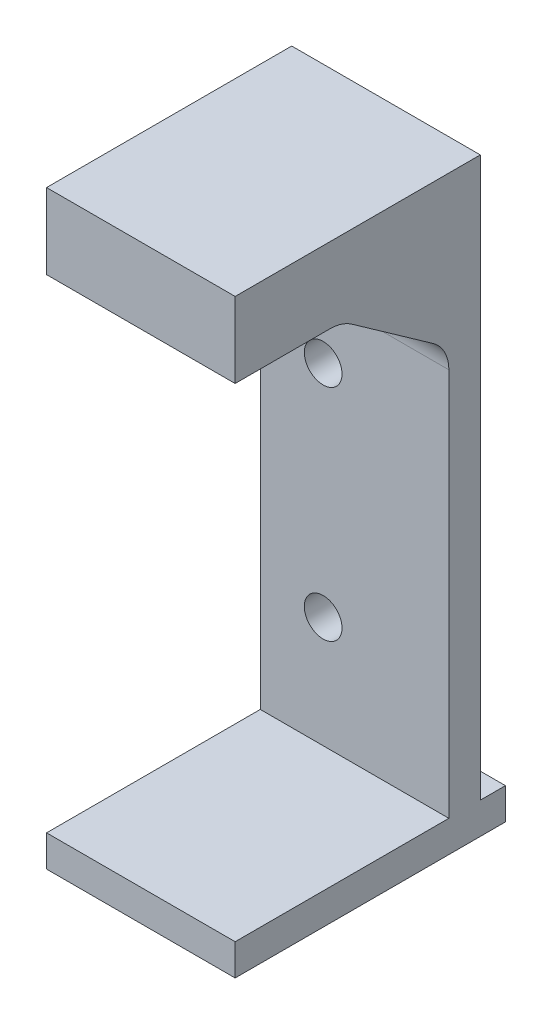
from build123d import *

# Parameters (mm, degrees)
SKETCH1_W                = 15
SKETCH1_H                = 28.85
SKETCH1_R                = 1.5
BOSS_EXTRUDE1_DEPTH      = 2.5
BOSS_EXTRUDE2_DEPTH      = 17
BOSS_EXTRUDE2_DEPTH_BACK = 4.5
SKETCH3_W                = 15
SKETCH3_H                = 2
SKETCH4_W                = 15
SKETCH4_H                = 2.5
BOSS_EXTRUDE3_DEPTH      = 15.6
SKETCH5_W                = 15
SKETCH5_H                = 2.5
BOSS_EXTRUDE4_DEPTH      = 21.5
SKETCH6_W                = 15
SKETCH6_H                = 6
BOSS_EXTRUDE5_DEPTH      = 17
BOSS_EXTRUDE10_DEPTH     = 15
FILLET1_R                = 3


with BuildPart() as part:
    # Sketch1 → Boss-Extrude1 (new body)
    with BuildSketch(Plane.XY):
        with Locations((7.5, 14.425)):
            Rectangle(SKETCH1_W, SKETCH1_H)
        with Locations((5, 26.35)):
            Circle(SKETCH1_R, mode=Mode.SUBTRACT)
        with Locations((5, 8.85)):
            Circle(SKETCH1_R, mode=Mode.SUBTRACT)
    extrude(amount=BOSS_EXTRUDE1_DEPTH)

    # Sketch3 → Boss-Extrude2 (add, two sides: drawn at the far end of the back side and taken through both)
    with BuildSketch(Plane.XY.offset(2.5).offset(-BOSS_EXTRUDE2_DEPTH_BACK)):
        with Locations((7.5, -1)):
            Rectangle(SKETCH3_W, SKETCH3_H)
    extrude(amount=BOSS_EXTRUDE2_DEPTH + BOSS_EXTRUDE2_DEPTH_BACK)

    # Sketch4 → Boss-Extrude3 (add)
    with BuildSketch(Plane(origin=(0, 28.85, 0), x_dir=(1, 0, 0), z_dir=(0, 1, 0))):
        with Locations((7.5, -1.25)):
            Rectangle(SKETCH4_W, SKETCH4_H)
    extrude(amount=BOSS_EXTRUDE3_DEPTH)

    # Sketch5 → Boss-Extrude4 (add)
    with BuildSketch(Plane.XY.offset(19.5)):
        with Locations((7.5, -1.25)):
            Rectangle(SKETCH5_W, SKETCH5_H)
    extrude(amount=-BOSS_EXTRUDE4_DEPTH)

    # Sketch6 → Boss-Extrude5 (add)
    with BuildSketch(Plane.XY.offset(2.5)):
        with Locations((7.5, 41.45)):
            Rectangle(SKETCH6_W, SKETCH6_H)
    extrude(amount=BOSS_EXTRUDE5_DEPTH)

    # Sketch7 → Boss-Extrude10 (add)
    with BuildSketch(Plane(origin=(15, 0, 0), x_dir=(0, 0, -1), z_dir=(1, 0, 0))):
        Polygon((-11, 38.45), (-2.5, 32.45), (-2.5, 38.45), align=None)
    extrude(amount=-BOSS_EXTRUDE10_DEPTH)

    # Fillet1
    fillet1_edges = [part.edges().sort_by_distance(p)[0] for p in [
        (7.5, 38.45, 11),
        (7.5, 32.45, 2.5),
    ]]
    fillet(fillet1_edges, radius=FILLET1_R)


solid = part.part
